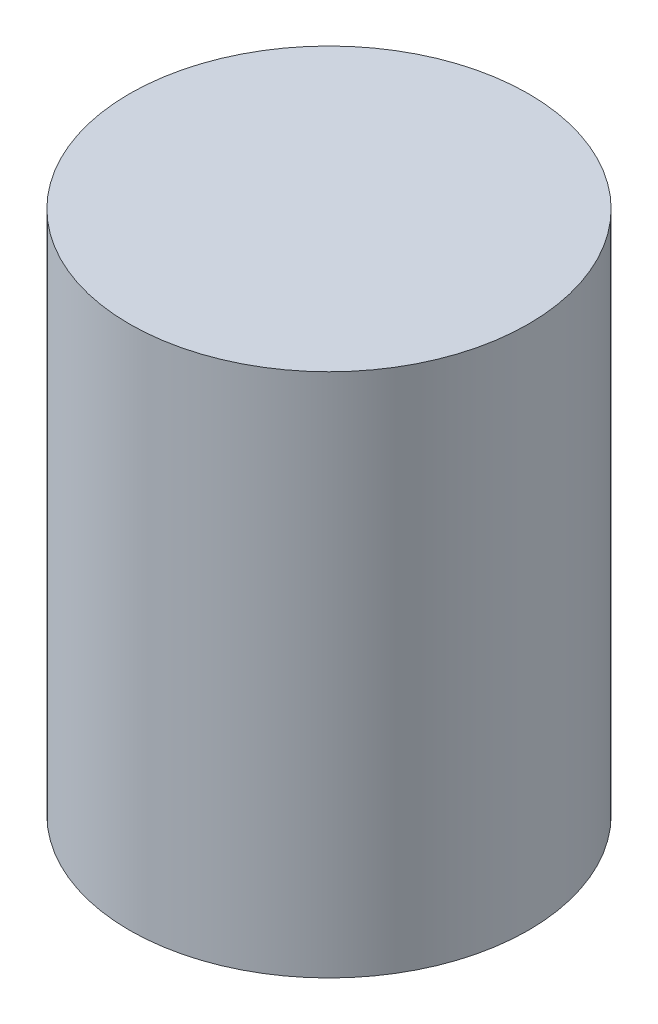
from build123d import *

# Parameters (mm, degrees)
ESBO_O1_R                = 9.5
RESSALTO_EXTRUS_O1_DEPTH = 25


with BuildPart() as part:
    # Esboço1 → Ressalto-extrusão1 (new body)
    with BuildSketch(Plane(origin=(0, 0, 0), x_dir=(1, 0, 0), z_dir=(0, 1, 0))):
        with Locations(Location((0, 0, 0), (0, 0, 270))):
            Circle(ESBO_O1_R)
    extrude(amount=RESSALTO_EXTRUS_O1_DEPTH)


solid = part.part
